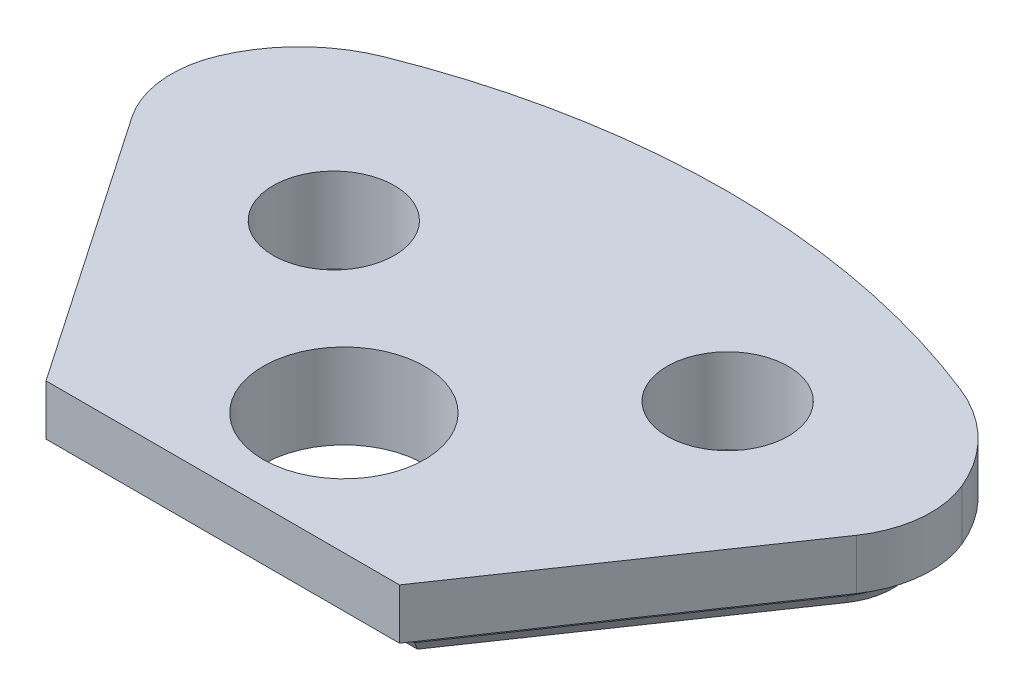
from build123d import *
from OCP.BRepFilletAPI import BRepFilletAPI_MakeChamfer

# Parameters (mm, degrees)
BOSS_EXTRUDE1_DEPTH = 5
FILLET2_R           = 15
FILLET3_R           = 10
SHELL1_T            = -3.2
BOSS_EXTRUDE2_DEPTH = 5.2
CHAMFER1_SIZE       = 1
CHAMFER1_SIZE2      = 0.577350269
SKETCH2_R           = 8
CUT_EXTRUDE1_DEPTH  = 64.128614634
SKETCH3_R           = 6
CUT_EXTRUDE2_DEPTH  = 64.128614634


with BuildPart() as part:
    # Sketch1 → Boss-Extrude1 (new body)
    with BuildSketch(Plane(origin=(0, 0, 0), x_dir=(1, 0, 0), z_dir=(0, 1, 0))):
        with BuildLine():
            Line((17.5, 0), (-17.5, 0))
            Line((-17.5, 0), (-38, 30))
            Line((-38, 30), (-38, 40))
            ThreePointArc((-38, 40), (0, 50), (38, 40))
            Line((38, 40), (38, 30))
            Line((38, 30), (17.5, 0))
        make_face()
    extrude(amount=BOSS_EXTRUDE1_DEPTH)

    # Fillet2
    fillet2_edges = [part.edges().sort_by_distance(p)[0] for p in [
        (-38, 2.5, -40),
        (38, 2.5, -40),
    ]]
    fillet(fillet2_edges, radius=FILLET2_R)

    # Fillet3
    fillet3_edges = [part.edges().sort_by_distance(p)[0] for p in [
        (38, 2.5, -30),
        (-38, 2.5, -30),
    ]]
    fillet(fillet3_edges, radius=FILLET3_R)

    # Shell1
    shell1_openings = [part.faces().sort_by_distance(p)[0] for p in [
        (0, 0, -26.14204648),
    ]]
    offset(amount=SHELL1_T, openings=shell1_openings)

    # Sketch5 → Boss-Extrude2 (add)
    with BuildSketch(Plane.XZ.offset(-1.8)):
        with BuildLine():
            Line((15.810907243, -3.2), (-15.810907243, -3.2))
            Line((-15.810907243, -3.2), (-33.226375888, -28.686051676))
            ThreePointArc((-33.226375888, -28.686051676), (-34.377028804, -31.833866159), (-33.88430189, -35.148976767))
            ThreePointArc((-33.88430189, -35.148976767), (-31.269334859, -39.009074238), (-27.363344051, -41.554980927))
            ThreePointArc((-27.363344051, -41.554980927), (0, -46.8), (27.363344051, -41.554980927))
            ThreePointArc((27.363344051, -41.554980927), (31.269334859, -39.009074238), (33.88430189, -35.148976767))
            ThreePointArc((33.88430189, -35.148976767), (34.377028804, -31.833866159), (33.226375888, -28.686051676))
            Line((33.226375888, -28.686051676), (15.810907243, -3.2))
        make_face()
    extrude(amount=BOSS_EXTRUDE2_DEPTH)

    # Chamfer1: one chamfer whose edges measure the first distance from different faces: ONE call of the kernel's chamfer builder (chamfer() names one face for all edges)
    chamfer1_edges_1 = [part.edges().sort_by_distance(p)[0] for p in [
        (24.518641566, -3.4, -15.943025838),
    ]]
    chamfer1_side_1 = [part.faces().sort_by_distance(p)[0] for p in [
        (24.518641566, -1.7, -15.943025838),
    ]]
    chamfer1_edges_2 = [part.edges().sort_by_distance(p)[0] for p in [
        (0, -3.4, -3.2),
    ]]
    chamfer1_side_2 = [part.faces().sort_by_distance(p)[0] for p in [
        (0, -1.7, -3.2),
    ]]
    chamfer1_edges_3 = [part.edges().sort_by_distance(p)[0] for p in [
        (-24.518641566, -3.4, -15.943025838),
    ]]
    chamfer1_side_3 = [part.faces().sort_by_distance(p)[0] for p in [
        (-24.518641566, -1.7, -15.943025838),
    ]]
    chamfer1_edges_4 = [part.edges().sort_by_distance(p)[0] for p in [
        (-34.377028804, -3.4, -31.833866159),
    ]]
    chamfer1_side_4 = [part.faces().sort_by_distance(p)[0] for p in [
        (-34.377028804, -1.7, -31.833866159),
    ]]
    chamfer1_edges_5 = [part.edges().sort_by_distance(p)[0] for p in [
        (-31.269334859, -3.4, -39.009074238),
    ]]
    chamfer1_side_5 = [part.faces().sort_by_distance(p)[0] for p in [
        (-31.269334859, -1.7, -39.009074238),
    ]]
    chamfer1_edges_6 = [part.edges().sort_by_distance(p)[0] for p in [
        (0, -3.4, -46.8),
    ]]
    chamfer1_side_6 = [part.faces().sort_by_distance(p)[0] for p in [
        (0, -1.7, -46.8),
    ]]
    chamfer1_edges_7 = [part.edges().sort_by_distance(p)[0] for p in [
        (31.269334859, -3.4, -39.009074238),
    ]]
    chamfer1_side_7 = [part.faces().sort_by_distance(p)[0] for p in [
        (31.269334859, -1.7, -39.009074238),
    ]]
    chamfer1_edges_8 = [part.edges().sort_by_distance(p)[0] for p in [
        (34.377028804, -3.4, -31.833866159),
    ]]
    chamfer1_side_8 = [part.faces().sort_by_distance(p)[0] for p in [
        (34.377028804, -1.7, -31.833866159),
    ]]
    chamfer1 = BRepFilletAPI_MakeChamfer(part.part.solid().wrapped)
    for e in chamfer1_edges_1:
        chamfer1.Add(CHAMFER1_SIZE, CHAMFER1_SIZE2, e.wrapped, chamfer1_side_1[0].wrapped)  # the first distance lies on this face
    for e in chamfer1_edges_2:
        chamfer1.Add(CHAMFER1_SIZE, CHAMFER1_SIZE2, e.wrapped, chamfer1_side_2[0].wrapped)  # the first distance lies on this face
    for e in chamfer1_edges_3:
        chamfer1.Add(CHAMFER1_SIZE, CHAMFER1_SIZE2, e.wrapped, chamfer1_side_3[0].wrapped)  # the first distance lies on this face
    for e in chamfer1_edges_4:
        chamfer1.Add(CHAMFER1_SIZE, CHAMFER1_SIZE2, e.wrapped, chamfer1_side_4[0].wrapped)  # the first distance lies on this face
    for e in chamfer1_edges_5:
        chamfer1.Add(CHAMFER1_SIZE, CHAMFER1_SIZE2, e.wrapped, chamfer1_side_5[0].wrapped)  # the first distance lies on this face
    for e in chamfer1_edges_6:
        chamfer1.Add(CHAMFER1_SIZE, CHAMFER1_SIZE2, e.wrapped, chamfer1_side_6[0].wrapped)  # the first distance lies on this face
    for e in chamfer1_edges_7:
        chamfer1.Add(CHAMFER1_SIZE, CHAMFER1_SIZE2, e.wrapped, chamfer1_side_7[0].wrapped)  # the first distance lies on this face
    for e in chamfer1_edges_8:
        chamfer1.Add(CHAMFER1_SIZE, CHAMFER1_SIZE2, e.wrapped, chamfer1_side_8[0].wrapped)  # the first distance lies on this face
    add(Compound.cast(chamfer1.Shape()), mode=Mode.REPLACE)

    # Sketch2 → Cut-Extrude1 (cut, through all)
    with BuildSketch(Plane(origin=(0, 5, 0), x_dir=(1, 0, 0), z_dir=(0, 1, 0))):
        with Locations(Location((0, 12, 0), (0, 0, 270))):
            Circle(SKETCH2_R)
    extrude(amount=-CUT_EXTRUDE1_DEPTH, mode=Mode.SUBTRACT)

    # Sketch3 → Cut-Extrude2 (cut, through all)
    with BuildSketch(Plane(origin=(0, 5, 0), x_dir=(1, 0, 0), z_dir=(0, 1, 0))):
        with Locations(Location((-17, 28, 0), (0, 0, 270))):
            Circle(SKETCH3_R)
        with Locations(Location((18, 32, 0), (0, 0, 270))):
            Circle(SKETCH3_R)
    extrude(amount=-CUT_EXTRUDE2_DEPTH, mode=Mode.SUBTRACT)


solid = part.part
